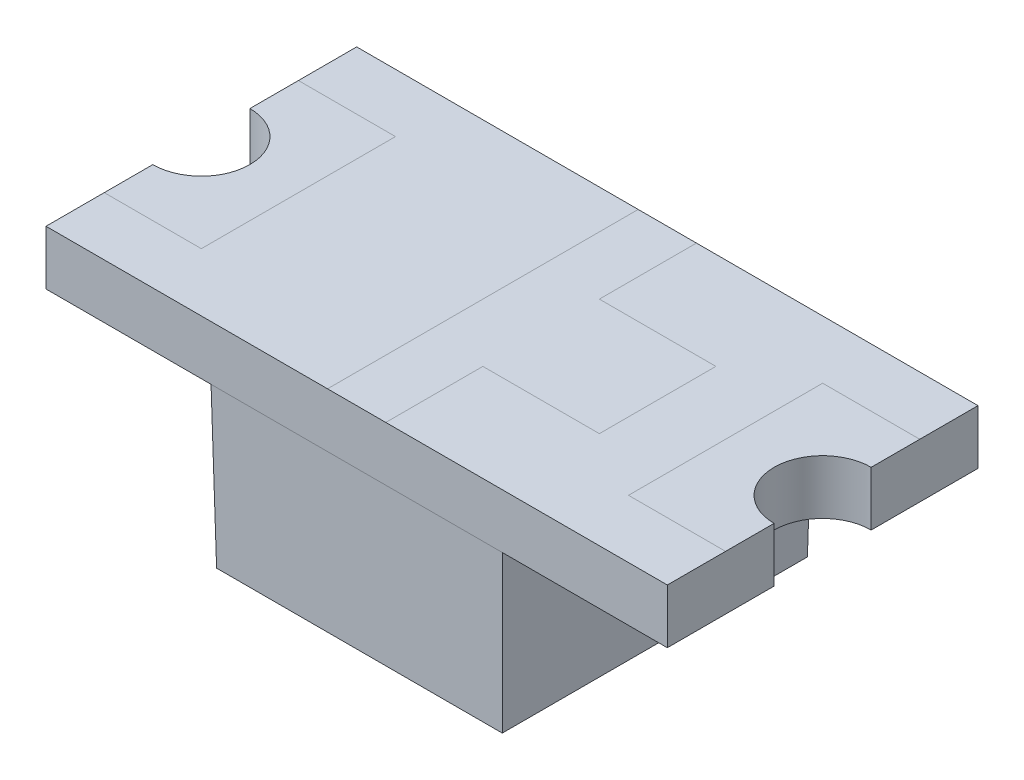
from build123d import *

# Parameters (mm, degrees)
SKETCH1_W           = 3.2
SKETCH1_H           = 1.6
BOSS_EXTRUDE1_DEPTH = 0.28
SKETCH2_W           = 1.5
SKETCH2_H           = 1.6
BOSS_EXTRUDE2_DEPTH = 0.82
BOSS_EXTRUDE2_TAPER = 1
SKETCH3_W           = 0.2
SKETCH3_H           = 0.2
BOSS_EXTRUDE3_DEPTH = 0.2
SKETCH6_R           = 0.25
CUT_EXTRUDE1_DEPTH  = 3.10000009


with BuildPart() as part:
    # Sketch1 → Boss-Extrude1 (new body)
    with BuildSketch(Plane(origin=(0, 0, 0), x_dir=(1, 0, 0), z_dir=(0, 1, 0))):
        Rectangle(SKETCH1_W, SKETCH1_H)
    extrude(amount=BOSS_EXTRUDE1_DEPTH)

    # Sketch6 → Cut-Extrude1 (cut, through all)
    with BuildSketch(Plane(origin=(0, 0.28, 0), x_dir=(1, 0, 0), z_dir=(0, 1, 0))):
        with Locations((-1.6, 0)):
            Circle(SKETCH6_R)
        with Locations((1.6, 0)):
            Circle(SKETCH6_R)
    extrude(amount=-CUT_EXTRUDE1_DEPTH, mode=Mode.SUBTRACT)


with BuildPart() as body_2:
    # Sketch2 → Boss-Extrude2 (new body)
    with BuildSketch(Plane.XZ):
        Rectangle(SKETCH2_W, SKETCH2_H)
    extrude(amount=BOSS_EXTRUDE2_DEPTH, taper=BOSS_EXTRUDE2_TAPER)


with BuildPart() as body_3:
    # Sketch3 → Boss-Extrude3 (new body)
    with BuildSketch(Plane.XZ):
        with Locations((0.25, 0)):
            Rectangle(SKETCH3_W, SKETCH3_H)
    extrude(amount=BOSS_EXTRUDE3_DEPTH)


solid = Compound([part.part, body_2.part, body_3.part])
